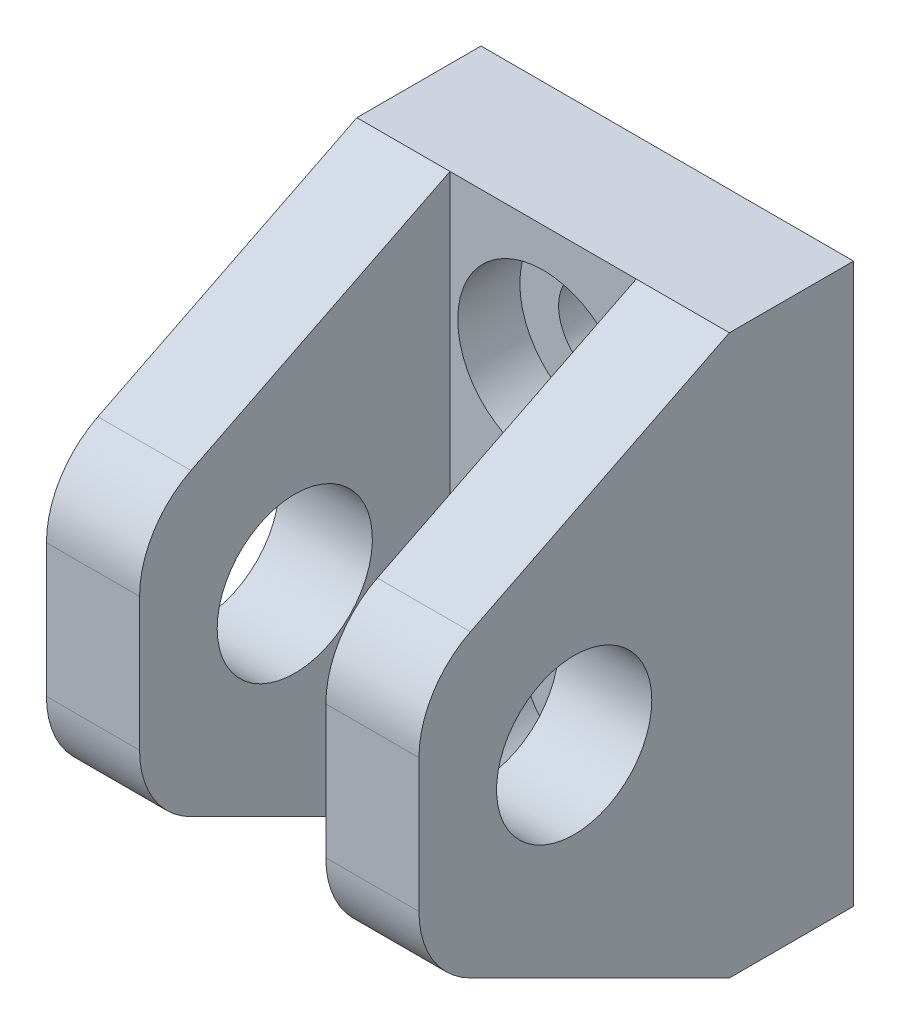
from build123d import *

# Parameters (mm, degrees)
SKETCH_1_W          = 20
SKETCH_1_H          = 18
EXTRUDE_1_DEPTH     = 4
SKETCH_2_W          = 3
SKETCH_2_H          = 18
EXTRUDE_2_DEPTH     = 10
CUT_EXTRUDE_1_DEPTH = 28.856776554
SKETCH_6_R          = 2.5
CUT_EXTRUDE_2_DEPTH = 28.856776554
FILLET_1_R          = 3
SKETCH_9_W          = 4
SKETCH_9_H          = 18
CUT_EXTRUDE_4_DEPTH = 29.705400189
SKETCH_10_W         = 4
SKETCH_10_H         = 18
CUT_EXTRUDE_5_DEPTH = 29.705400189
SKETCH_11_R         = 1.5
CUT_EXTRUDE_6_DEPTH = 27.076809621
SKETCH_12_R         = 2.75
CUT_EXTRUDE_7_DEPTH = 2


with BuildPart() as part:
    # 草图1 → 凸台-拉伸1 (new body)
    with BuildSketch(Plane.XY):
        with Locations((10, 9)):
            Rectangle(SKETCH_1_W, SKETCH_1_H)
    extrude(amount=EXTRUDE_1_DEPTH)

    # 草图2 → 凸台-拉伸2 (add)
    with BuildSketch(Plane.XY.offset(4)):
        with Locations((14.5, 9)):
            Rectangle(SKETCH_2_W, SKETCH_2_H)
        with Locations((5.5, 9)):
            Rectangle(SKETCH_2_W, SKETCH_2_H)
    extrude(amount=EXTRUDE_2_DEPTH)

    # 草图3 → 切除-拉伸1 (cut, through all)
    with BuildSketch(Plane.ZY.offset(-4)):
        Polygon((4, 18), (14, 13), (14, 19.313508938), align=None)
        Polygon((4, 0), (14, 5), (15.372444732, -0.863940538), align=None)
    extrude(amount=-CUT_EXTRUDE_1_DEPTH, mode=Mode.SUBTRACT)

    # 草图6 → 切除-拉伸2 (cut, through all)
    with BuildSketch(Plane(origin=(16, 0, 0), x_dir=(0, 0, -1), z_dir=(1, 0, 0))):
        with Locations(Location((-9, 9, 0), (0, 0, 90))):
            Circle(SKETCH_6_R)
    extrude(amount=-CUT_EXTRUDE_2_DEPTH, mode=Mode.SUBTRACT)

    # 圆角1
    fillet_1_edges = [part.edges().sort_by_distance(p)[0] for p in [
        (5.5, 13, 14),
        (14.5, 13, 14),
        (5.5, 5, 14),
        (14.5, 5, 14),
    ]]
    fillet(fillet_1_edges, radius=FILLET_1_R)

    # 草图9 → 切除-拉伸4 (cut, through all)
    with BuildSketch(Plane.XY.offset(4)):
        with Locations((2, 9)):
            Rectangle(SKETCH_9_W, SKETCH_9_H)
    extrude(amount=-CUT_EXTRUDE_4_DEPTH, mode=Mode.SUBTRACT)

    # 草图10 → 切除-拉伸5 (cut, through all)
    with BuildSketch(Plane.XY.offset(4)):
        with Locations((18, 9)):
            Rectangle(SKETCH_10_W, SKETCH_10_H)
    extrude(amount=-CUT_EXTRUDE_5_DEPTH, mode=Mode.SUBTRACT)

    # 草图11 → 切除-拉伸6 (cut, through all)
    with BuildSketch(Plane.XY.offset(4)):
        with Locations((10, 14)):
            Circle(SKETCH_11_R)
        with Locations((10, 4)):
            Circle(SKETCH_11_R)
    extrude(amount=-CUT_EXTRUDE_6_DEPTH, mode=Mode.SUBTRACT)

    # 草图12 → 切除-拉伸7 (cut)
    with BuildSketch(Plane.XY.offset(4)):
        with Locations((10, 14)):
            Circle(SKETCH_12_R)
        with Locations((10, 4)):
            Circle(SKETCH_12_R)
    extrude(amount=-CUT_EXTRUDE_7_DEPTH, mode=Mode.SUBTRACT)


solid = part.part
